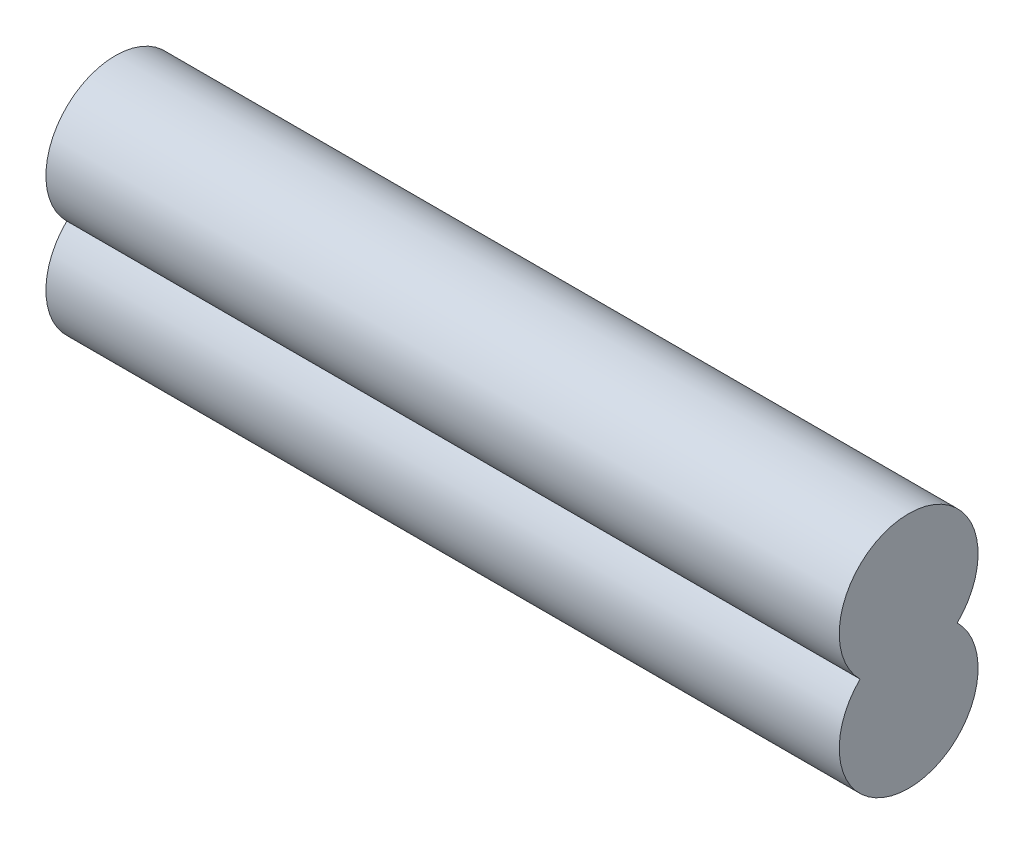
from build123d import *

# Parameters (mm, degrees)
SKETCH2_W           = 12.7
SKETCH2_H           = 12.7
BOSS_EXTRUDE1_DEPTH = 40.64
SKETCH3_W           = 12.7
SKETCH3_H           = 12.7
CUT_EXTRUDE2_DEPTH  = 42.620362805


with BuildPart() as part:
    # Sketch2 → Boss-Extrude1 (new body)
    with BuildSketch(Plane(origin=(0, 0, 0), x_dir=(0, 0, -1), z_dir=(1, 0, 0))):
        Rectangle(SKETCH2_W, SKETCH2_H)
    extrude(amount=BOSS_EXTRUDE1_DEPTH)

    # Sketch3 → Cut-Extrude2 (cut, through all)
    with BuildSketch(Plane.ZY):
        Rectangle(SKETCH3_W, SKETCH3_H)
        with BuildLine():
            ThreePointArc((2.488681579, 0), (3.278329429, -1.162432523), (3.556, -2.54))
            ThreePointArc((3.556, -2.54), (-1.377567477, -5.818329429), (-2.488681579, 0))
            ThreePointArc((-2.488681579, 0), (-1.377567477, 5.818329429), (3.556, 2.54))
            ThreePointArc((3.556, 2.54), (3.278329429, 1.162432523), (2.488681579, 0))
        make_face(mode=Mode.SUBTRACT)
    extrude(amount=-CUT_EXTRUDE2_DEPTH, mode=Mode.SUBTRACT)


solid = part.part
